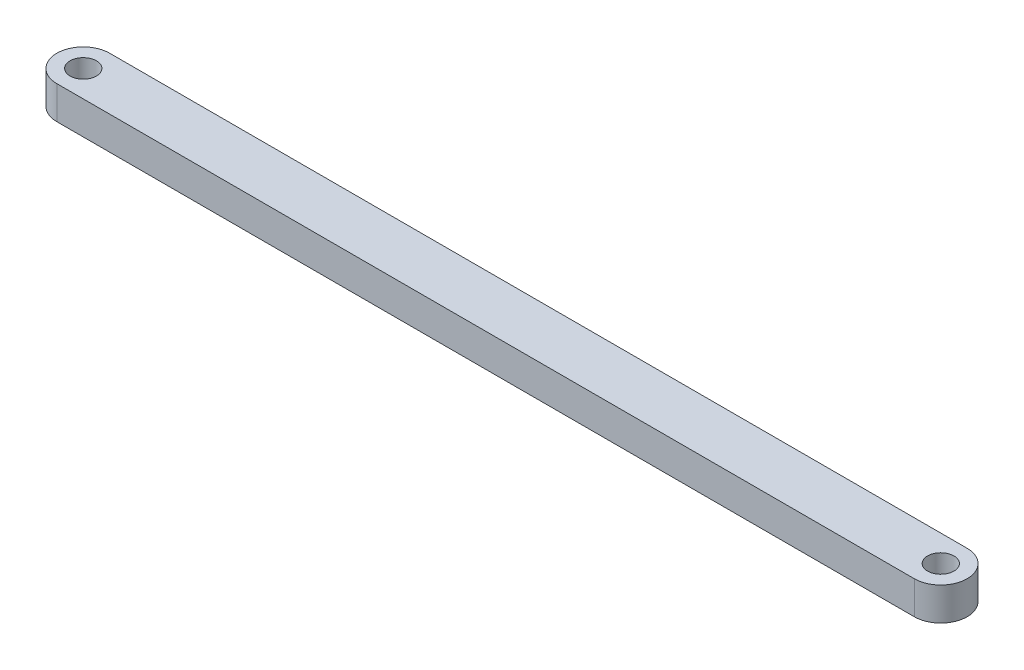
from build123d import *

# Parameters (mm, degrees)
SKETCH1_R           = 4
BOSS_EXTRUDE1_DEPTH = 10


with BuildPart() as part:
    # Sketch1 → Boss-Extrude1 (new body)
    with BuildSketch(Plane(origin=(0, 0, 0), x_dir=(1, 0, 0), z_dir=(0, 1, 0))):
        with BuildLine():
            Line((-130, 0), (130, 0))
            ThreePointArc((130, 0), (138, -8), (130, -16))
            Line((130, -16), (-130, -16))
            ThreePointArc((-130, -16), (-138, -8), (-130, 0))
        make_face()
        with Locations(Location((-130, -8, 0), (0, 0, 270))):
            Circle(SKETCH1_R, mode=Mode.SUBTRACT)
        with Locations(Location((130, -8, 0), (0, 0, 270))):
            Circle(SKETCH1_R, mode=Mode.SUBTRACT)
    extrude(amount=BOSS_EXTRUDE1_DEPTH)


solid = part.part
